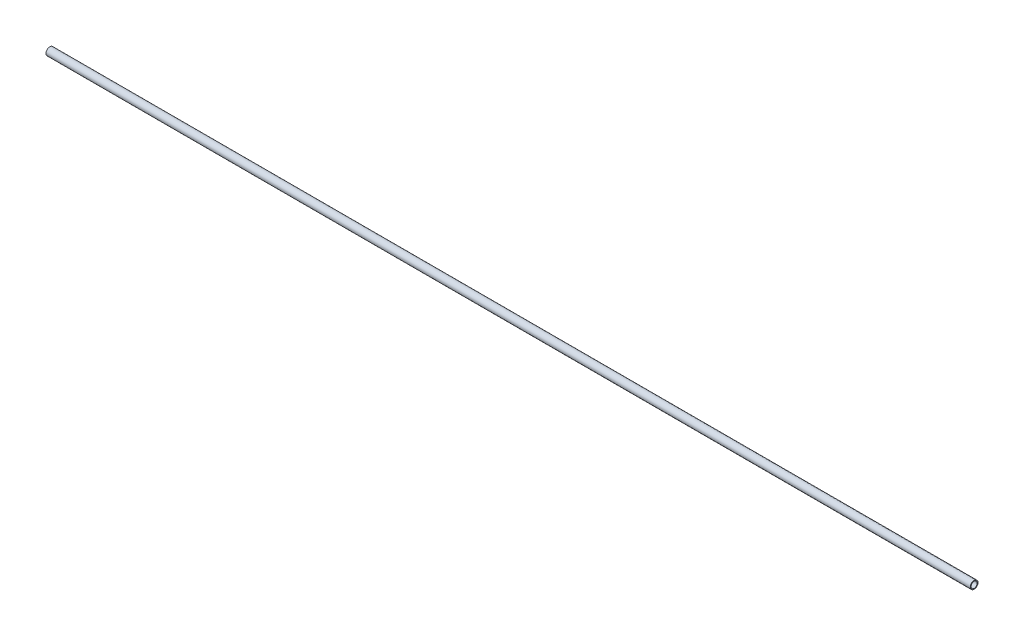
from build123d import *

# Parameters (mm, degrees)
SKETCH1_R           = 6.35
SKETCH1_R_2         = 5.08
BOSS_EXTRUDE1_DEPTH = 1524


with BuildPart() as part:
    # Sketch1 → Boss-Extrude1 (new body)
    with BuildSketch(Plane(origin=(0, 0, 0), x_dir=(0, 0, -1), z_dir=(1, 0, 0))):
        Circle(SKETCH1_R)
        Circle(SKETCH1_R_2, mode=Mode.SUBTRACT)
    extrude(amount=BOSS_EXTRUDE1_DEPTH)


solid = part.part
